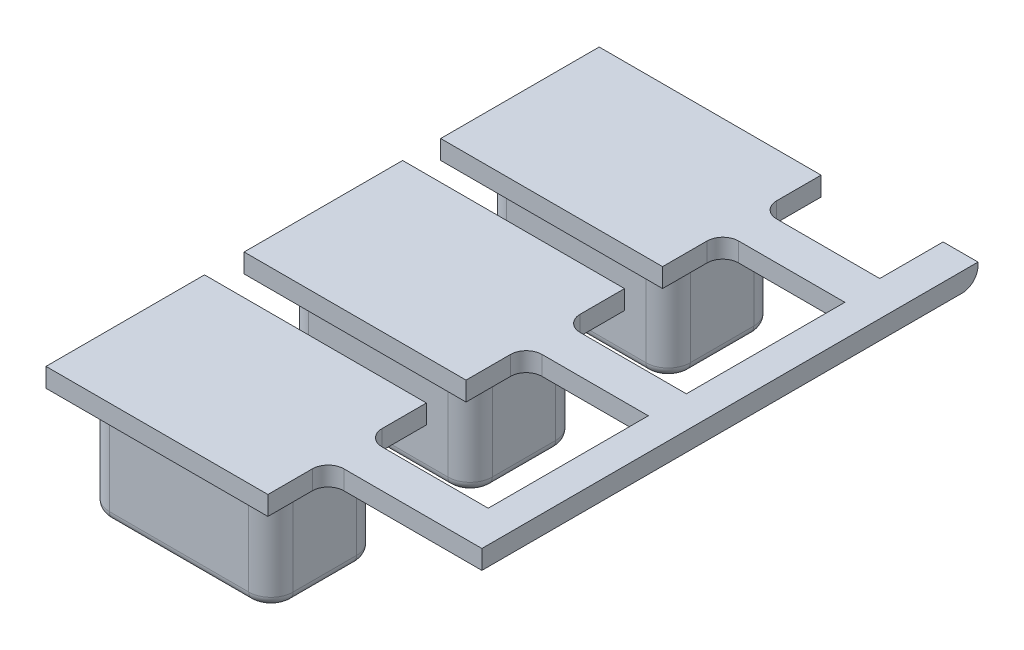
from build123d import *

# Parameters (mm, degrees)
EXTRUDE_1_DEPTH   = 4
EXTRUDE_1_2_DEPTH = 4
EXTRUDE_1_3_DEPTH = 4
SKETCH_2_W        = 7
SKETCH_2_H        = 5
EXTRUDE_2_DEPTH   = 0.6
SKETCH_3_W        = 4.85
SKETCH_3_H        = 1.2
EXTRUDE_3_DEPTH   = 0.6
SKETCH_4_W        = 1
SKETCH_4_H        = 13.65
EXTRUDE_4_DEPTH   = 0.6
FILLET_1_R        = 0.5
FILLET_2_R        = 0.3
SKETCH_5_W        = 1.1
SKETCH_5_H        = 0.6
EXTRUDE_5_DEPTH   = 2
FILLET_3_R        = 0.5


with BuildPart() as part:
    # 草图1 → 凸台-拉伸1 (new body)
    with BuildSketch(Plane(origin=(0, 0, 0), x_dir=(1, 0, 0), z_dir=(0, 1, 0))):
        with BuildLine():
            Line((-2.2, 1.245389122), (2.2, 1.245389122))
            ThreePointArc((2.2, 1.245389122), (2.694974747, 1.040363869), (2.9, 0.545389122))
            Line((2.9, 0.545389122), (2.9, -1.454610878))
            ThreePointArc((2.9, -1.454610878), (2.694974747, -1.949585625), (2.2, -2.154610878))
            Line((2.2, -2.154610878), (-2.2, -2.154610878))
            ThreePointArc((-2.2, -2.154610878), (-2.694974747, -1.949585625), (-2.9, -1.454610878))
            Line((-2.9, -1.454610878), (-2.9, 0.545389122))
            ThreePointArc((-2.9, 0.545389122), (-2.694974747, 1.040363869), (-2.2, 1.245389122))
        make_face()
    extrude(amount=EXTRUDE_1_DEPTH)



with BuildPart() as body_2:
    # 草图1 → Extrude 1 2 (new body)
    with BuildSketch(Plane(origin=(0, 0, 0), x_dir=(1, 0, 0), z_dir=(0, 1, 0))):
        with BuildLine():
            Line((-2.2, 7.528722779), (2.2, 7.528722779))
            ThreePointArc((2.2, 7.528722779), (2.694974747, 7.323697526), (2.9, 6.828722779))
            Line((2.9, 6.828722779), (2.9, 4.828722779))
            ThreePointArc((2.9, 4.828722779), (2.694974747, 4.333748032), (2.2, 4.128722779))
            Line((2.2, 4.128722779), (-2.2, 4.128722779))
            ThreePointArc((-2.2, 4.128722779), (-2.694974747, 4.333748032), (-2.9, 4.828722779))
            Line((-2.9, 4.828722779), (-2.9, 6.828722779))
            ThreePointArc((-2.9, 6.828722779), (-2.694974747, 7.323697526), (-2.2, 7.528722779))
        make_face()
    extrude(amount=EXTRUDE_1_2_DEPTH)


with BuildPart() as body_3:
    # 草图1 → Extrude 1 3 (new body)
    with BuildSketch(Plane(origin=(0, 0, 0), x_dir=(1, 0, 0), z_dir=(0, 1, 0))):
        with BuildLine():
            Line((-2.2, 13.775919566), (2.2, 13.775919566))
            ThreePointArc((2.2, 13.775919566), (2.694974747, 13.570894313), (2.9, 13.075919566))
            Line((2.9, 13.075919566), (2.9, 11.075919566))
            ThreePointArc((2.9, 11.075919566), (2.694974747, 10.580944819), (2.2, 10.375919566))
            Line((2.2, 10.375919566), (-2.2, 10.375919566))
            ThreePointArc((-2.2, 10.375919566), (-2.694974747, 10.580944819), (-2.9, 11.075919566))
            Line((-2.9, 11.075919566), (-2.9, 13.075919566))
            ThreePointArc((-2.9, 13.075919566), (-2.694974747, 13.570894313), (-2.2, 13.775919566))
        make_face()
    extrude(amount=EXTRUDE_1_3_DEPTH)


with BuildPart() as part_1:
    add(part.part)

    add(body_2.part)  # 凸台-拉伸2 merges body 2

    add(body_3.part)  # 凸台-拉伸2 merges body 3
    # 草图2 → 凸台-拉伸2 (add)
    with BuildSketch(Plane(origin=(0, 4, 0), x_dir=(1, 0, 0), z_dir=(0, 1, 0))):
        with Locations((0.036699987, 12.063062551)):
            Rectangle(SKETCH_2_W, SKETCH_2_H)
        with Locations((0.036699987, 5.863062551)):
            Rectangle(SKETCH_2_W, SKETCH_2_H)
        with Locations((0.036699987, -0.386937449)):
            Rectangle(SKETCH_2_W, SKETCH_2_H)
    extrude(amount=-EXTRUDE_2_DEPTH)

    # 草图3 → 凸台-拉伸3 (add)
    with BuildSketch(Plane(origin=(0, 4, 0), x_dir=(1, 0, 0), z_dir=(0, 1, 0))):
        with Locations((5.961699987, 12.063062551)):
            Rectangle(SKETCH_3_W, SKETCH_3_H)
        with Locations((5.961699987, 5.863062551)):
            Rectangle(SKETCH_3_W, SKETCH_3_H)
        with Locations((5.961699987, -0.386937449)):
            Rectangle(SKETCH_3_W, SKETCH_3_H)
    extrude(amount=-EXTRUDE_3_DEPTH)

    # 草图4 → 凸台-拉伸4 (add)
    with BuildSketch(Plane.XZ.offset(-3.4)):
        with Locations((7.886699987, -5.838062551)):
            Rectangle(SKETCH_4_W, SKETCH_4_H)
    extrude(amount=-EXTRUDE_4_DEPTH)

    # 圆角1
    fillet_1_edges = [part_1.edges().sort_by_distance(p)[0] for p in [
        (3.536699987, 3.7, -11.463062551),
        (3.536699987, 3.7, -12.663062551),
        (3.536699987, 3.7, 0.986937449),
        (3.536699987, 3.7, -0.213062551),
        (3.536699987, 3.7, -5.263062551),
        (3.536699987, 3.7, -6.463062551),
    ]]
    fillet(fillet_1_edges, radius=FILLET_1_R)

    # 圆角2
    fillet_2_edges = [part_1.edges().sort_by_distance(p)[0] for p in [
        (-2.9, 0, 0.454610878),
        (-2.694974747, 0, -1.040363869),
        (-2.694974747, 0, -13.570894313),
        (-2.9, 0, -12.075919566),
        (-2.694974747, 0, -10.580944819),
        (0, 0, -10.375919566),
        (2.694974747, 0, -10.580944819),
        (2.9, 0, -12.075919566),
        (2.694974747, 0, -13.570894313),
        (0, 0, -13.775919566),
        (0, 0, -1.245389122),
        (2.694974747, 0, -1.040363869),
        (2.9, 0, 0.454610878),
        (2.694974747, 0, 1.949585625),
        (-2.694974747, 0, -7.323697526),
        (-2.9, 0, -5.828722779),
        (-2.694974747, 0, -4.333748032),
        (0, 0, -4.128722779),
        (2.694974747, 0, -4.333748032),
        (2.9, 0, -5.828722779),
        (0, 0, 2.154610878),
        (2.694974747, 0, -7.323697526),
        (0, 0, -7.528722779),
        (-2.694974747, 0, 1.949585625),
    ]]
    fillet(fillet_2_edges, radius=FILLET_2_R)

    # 草图5 → 凸台-拉伸5 (add)
    with BuildSketch(Plane(origin=(0, 0, -12.663062551), x_dir=(-1, 0, 0), z_dir=(0, 0, -1))):
        with Locations((-7.836699987, 3.7)):
            Rectangle(SKETCH_5_W, SKETCH_5_H)
    extrude(amount=EXTRUDE_5_DEPTH)

    # 圆角3
    fillet_3_edges = [part_1.edges().sort_by_distance(p)[0] for p in [
        (7.836699987, 3.4, -14.663062551),
    ]]
    fillet(fillet_3_edges, radius=FILLET_3_R)


solid = part_1.part
